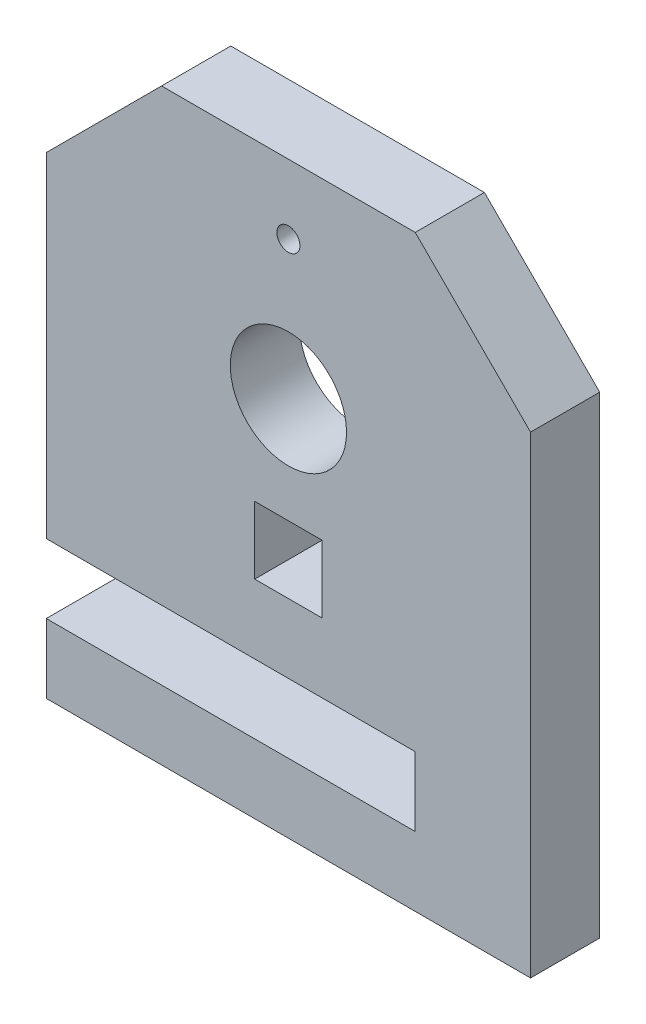
from build123d import *

# Parameters (mm, degrees)
SKETCH1_W           = 2.92
SKETCH1_H           = 2.92
SKETCH1_R           = 2.52
SKETCH1_R_2         = 0.5
BOSS_EXTRUDE1_DEPTH = 3


with BuildPart() as part:
    # Sketch1 → Boss-Extrude1 (new body)
    with BuildSketch(Plane.XY):
        Polygon((13.5482559, 6.709731544), (8.5482559, 11.709731544), (-2.4517441, 11.709731544), (-7.4517441, 6.709731544), (-7.4517441, -7.790268456), (8.5482559, -7.790268456), (8.5482559, -10.790268456), (-7.4517441, -10.790268456), (-7.4517441, -13.790268456), (13.5482559, -13.790268456), align=None)
        with Locations((3.0482559, -3.330268456)):
            Rectangle(SKETCH1_W, SKETCH1_H, mode=Mode.SUBTRACT)
        with Locations((3.0482559, 2.709731544)):
            Circle(SKETCH1_R, mode=Mode.SUBTRACT)
        with Locations((3.0482559, 8.709731544)):
            Circle(SKETCH1_R_2, mode=Mode.SUBTRACT)
    extrude(amount=BOSS_EXTRUDE1_DEPTH)


solid = part.part
